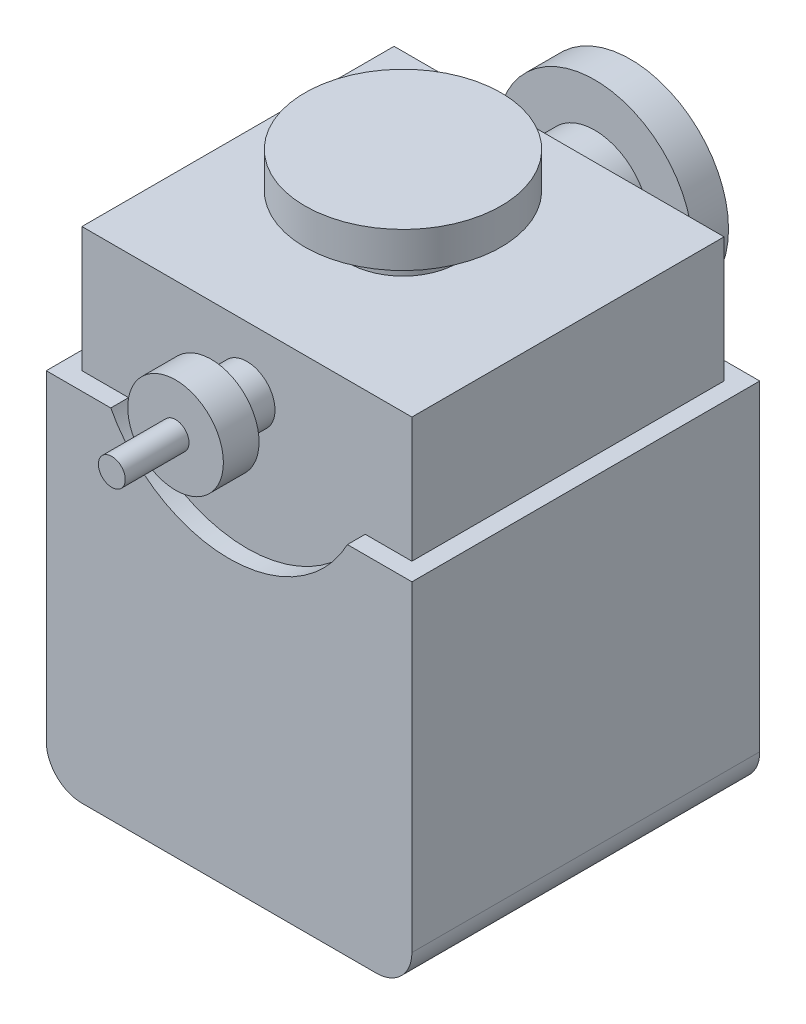
from build123d import *

# Parameters (mm, degrees)
SKETCH1_R           = 34.925
BOSS_EXTRUDE1_DEPTH = 12.69
SKETCH2_R           = 19.4
BOSS_EXTRUDE2_DEPTH = 12.69
SKETCH7_W           = 117.475
SKETCH7_H           = 111.125
BOSS_EXTRUDE3_DEPTH = 44.45
SKETCH8_W           = 130.175
SKETCH8_H           = 123.825
BOSS_EXTRUDE4_DEPTH = 127
FILLET1_R           = 12.7
FILLET2_R           = 12.7
SKETCH9_R           = 47.625
CUT_EXTRUDE1_DEPTH  = 228.91291732
SKETCH10_R          = 19.4
BOSS_EXTRUDE5_DEPTH = 12.7
SKETCH11_R          = 34.925
BOSS_EXTRUDE6_DEPTH = 12.7
SKETCH17_R          = 47.625
CUT_EXTRUDE3_DEPTH  = 239.291833434
SKETCH13_R          = 10
BOSS_EXTRUDE7_DEPTH = 12.7
SKETCH14_R          = 17.018
BOSS_EXTRUDE8_DEPTH = 12.7
SKETCH15_R          = 4.785590778
BOSS_EXTRUDE9_DEPTH = 22.7


with BuildPart() as part:
    # Sketch1 → Boss-Extrude1 (new body)
    with BuildSketch(Plane(origin=(0, 0, 0), x_dir=(1, 0, 0), z_dir=(0, 1, 0))):
        with Locations(Location((0, 0, 0), (0, 0, 270))):
            Circle(SKETCH1_R)
    extrude(amount=BOSS_EXTRUDE1_DEPTH)

    # Sketch2 → Boss-Extrude2 (add)
    with BuildSketch(Plane(origin=(0, 0, 0), x_dir=(-1, 0, 0), z_dir=(0, -1, 0))):
        with Locations(Location((0, 0, 0), (0, 0, 90))):
            Circle(SKETCH2_R)
    extrude(amount=BOSS_EXTRUDE2_DEPTH)

    # Sketch7 → Boss-Extrude3 (add)
    with BuildSketch(Plane.XZ.offset(12.69)):
        Rectangle(SKETCH7_W, SKETCH7_H)
    extrude(amount=BOSS_EXTRUDE3_DEPTH)

    # Sketch8 → Boss-Extrude4 (add)
    with BuildSketch(Plane.XZ.offset(57.14)):
        Rectangle(SKETCH8_W, SKETCH8_H)
    extrude(amount=BOSS_EXTRUDE4_DEPTH)

    # Fillet1
    fillet1_edges = [part.edges().sort_by_distance(p)[0] for p in [
        (65.0875, -184.14, 0),
    ]]
    fillet(fillet1_edges, radius=FILLET1_R)

    # Fillet2
    fillet2_edges = [part.edges().sort_by_distance(p)[0] for p in [
        (-65.0875, -184.14, 0),
    ]]
    fillet(fillet2_edges, radius=FILLET2_R)

    # Sketch9 → Cut-Extrude1 (cut, through all)
    with BuildSketch(Plane(origin=(0, 0, -55.5625), x_dir=(-1, 0, 0), z_dir=(0, 0, -1))):
        with Locations((0, -34.915)):
            Circle(SKETCH9_R)
    extrude(amount=CUT_EXTRUDE1_DEPTH, mode=Mode.SUBTRACT)

    # Sketch10 → Boss-Extrude5 (add)
    with BuildSketch(Plane(origin=(0, 0, -55.5625), x_dir=(-1, 0, 0), z_dir=(0, 0, -1))):
        with Locations(Location((0, -34.915, 0), (0, 0, 180))):
            Circle(SKETCH10_R)
    extrude(amount=BOSS_EXTRUDE5_DEPTH)

    # Sketch11 → Boss-Extrude6 (add)
    with BuildSketch(Plane(origin=(0, 0, -68.2625), x_dir=(-1, 0, 0), z_dir=(0, 0, -1))):
        with Locations((0, -34.915)):
            Circle(SKETCH11_R)
    extrude(amount=BOSS_EXTRUDE6_DEPTH)

    # Sketch17 → Cut-Extrude3 (cut, through all)
    with BuildSketch(Plane.XY.offset(55.5625)):
        with Locations((0, -34.915)):
            Circle(SKETCH17_R)
    extrude(amount=CUT_EXTRUDE3_DEPTH, mode=Mode.SUBTRACT)

    # Sketch13 → Boss-Extrude7 (add)
    with BuildSketch(Plane.XY.offset(55.5625)):
        with Locations(Location((0, -34.915, 0), (0, 0, 180))):
            Circle(SKETCH13_R)
    extrude(amount=BOSS_EXTRUDE7_DEPTH)

    # Sketch14 → Boss-Extrude8 (add)
    with BuildSketch(Plane.XY.offset(68.2625)):
        with Locations((0, -34.915)):
            Circle(SKETCH14_R)
    extrude(amount=BOSS_EXTRUDE8_DEPTH)

    # Sketch15 → Boss-Extrude9 (add)
    with BuildSketch(Plane.XY.offset(80.9625)):
        with Locations((0, -34.915)):
            Circle(SKETCH15_R)
    extrude(amount=BOSS_EXTRUDE9_DEPTH)


solid = part.part
